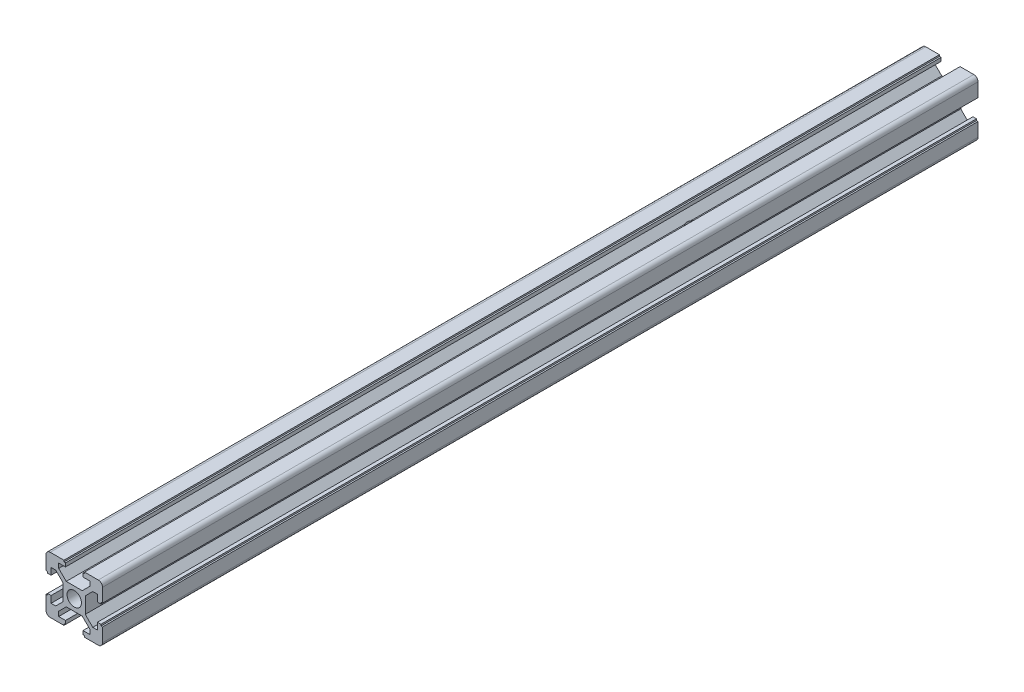
from build123d import *

# Parameters (mm, degrees)
SKETCH_2_R               = 2.55
EXTRUDE_1_DEPTH          = 310
CUT_EXTRUDE_1_DEPTH      = 311.805405358
CUT_EXTRUDE_1_DEPTH_BACK = 311.805405358
SKETCH_3_R               = 3


with BuildPart() as part:
    # 草图2 → 凸台-拉伸1 (new body)
    with BuildSketch(Plane.XY):
        with BuildLine():
            Line((-3.9, 2.839339828), (-6.560660172, 5.5))
            Line((-6.560660172, 5.5), (-8.2, 5.5))
            Line((-8.2, 5.5), (-8.2, 3.1))
            Line((-8.2, 3.1), (-9.45, 3.1))
            Line((-9.45, 3.1), (-9.45, 3.65))
            Line((-9.45, 3.65), (-10, 3.65))
            Line((-10, 3.65), (-10, 8.5))
            ThreePointArc((-10, 8.5), (-9.560660172, 9.560660172), (-8.5, 10))
            Line((-8.5, 10), (-3.65, 10))
            Line((-3.65, 10), (-3.65, 9.45))
            Line((-3.65, 9.45), (-3.1, 9.45))
            Line((-3.1, 9.45), (-3.1, 8.2))
            Line((-3.1, 8.2), (-5.5, 8.2))
            Line((-5.5, 8.2), (-5.5, 6.560660172))
            Line((-5.5, 6.560660172), (-2.839339828, 3.9))
            Line((-2.839339828, 3.9), (2.839339828, 3.9))
            Line((2.839339828, 3.9), (5.5, 6.560660172))
            Line((5.5, 6.560660172), (5.5, 8.2))
            Line((5.5, 8.2), (3.1, 8.2))
            Line((3.1, 8.2), (3.1, 9.45))
            Line((3.1, 9.45), (3.65, 9.45))
            Line((3.65, 9.45), (3.65, 10))
            Line((3.65, 10), (8.5, 10))
            ThreePointArc((8.5, 10), (9.560660172, 9.560660172), (10, 8.5))
            Line((10, 8.5), (10, 3.65))
            Line((10, 3.65), (9.45, 3.65))
            Line((9.45, 3.65), (9.45, 3.1))
            Line((9.45, 3.1), (8.2, 3.1))
            Line((8.2, 3.1), (8.2, 5.5))
            Line((8.2, 5.5), (6.560660172, 5.5))
            Line((6.560660172, 5.5), (3.9, 2.839339828))
            Line((3.9, 2.839339828), (3.9, -2.839339828))
            Line((3.9, -2.839339828), (6.560660172, -5.5))
            Line((6.560660172, -5.5), (8.2, -5.5))
            Line((8.2, -5.5), (8.2, -3.1))
            Line((8.2, -3.1), (9.45, -3.1))
            Line((9.45, -3.1), (9.45, -3.65))
            Line((9.45, -3.65), (10, -3.65))
            Line((10, -3.65), (10, -8.5))
            ThreePointArc((10, -8.5), (9.560660172, -9.560660172), (8.5, -10))
            Line((8.5, -10), (3.65, -10))
            Line((3.65, -10), (3.65, -9.45))
            Line((3.65, -9.45), (3.1, -9.45))
            Line((3.1, -9.45), (3.1, -8.2))
            Line((3.1, -8.2), (5.5, -8.2))
            Line((5.5, -8.2), (5.5, -6.560660172))
            Line((5.5, -6.560660172), (2.839339828, -3.9))
            Line((2.839339828, -3.9), (-2.839339828, -3.9))
            Line((-2.839339828, -3.9), (-5.5, -6.560660172))
            Line((-5.5, -6.560660172), (-5.5, -8.2))
            Line((-5.5, -8.2), (-3.1, -8.2))
            Line((-3.1, -8.2), (-3.1, -9.45))
            Line((-3.1, -9.45), (-3.65, -9.45))
            Line((-3.65, -9.45), (-3.65, -10))
            Line((-3.65, -10), (-8.5, -10))
            ThreePointArc((-8.5, -10), (-9.560660172, -9.560660172), (-10, -8.5))
            Line((-10, -8.5), (-10, -3.65))
            Line((-10, -3.65), (-9.45, -3.65))
            Line((-9.45, -3.65), (-9.45, -3.1))
            Line((-9.45, -3.1), (-8.2, -3.1))
            Line((-8.2, -3.1), (-8.2, -5.5))
            Line((-8.2, -5.5), (-6.560660172, -5.5))
            Line((-6.560660172, -5.5), (-3.9, -2.839339828))
            Line((-3.9, -2.839339828), (-3.9, 2.839339828))
        make_face()
        Circle(SKETCH_2_R, mode=Mode.SUBTRACT)
    extrude(amount=EXTRUDE_1_DEPTH)

    # 草图3 → 切除-拉伸1 (cut, two sides: drawn at the far end of the back side and taken through both)
    with BuildSketch(Plane.XZ.offset(10).offset(-CUT_EXTRUDE_1_DEPTH_BACK)):
        with Locations(Location((0, 90, 0), (0, 0, 341.164003842))):
            Circle(SKETCH_3_R)
    extrude(amount=CUT_EXTRUDE_1_DEPTH + CUT_EXTRUDE_1_DEPTH_BACK, mode=Mode.SUBTRACT)


solid = part.part
